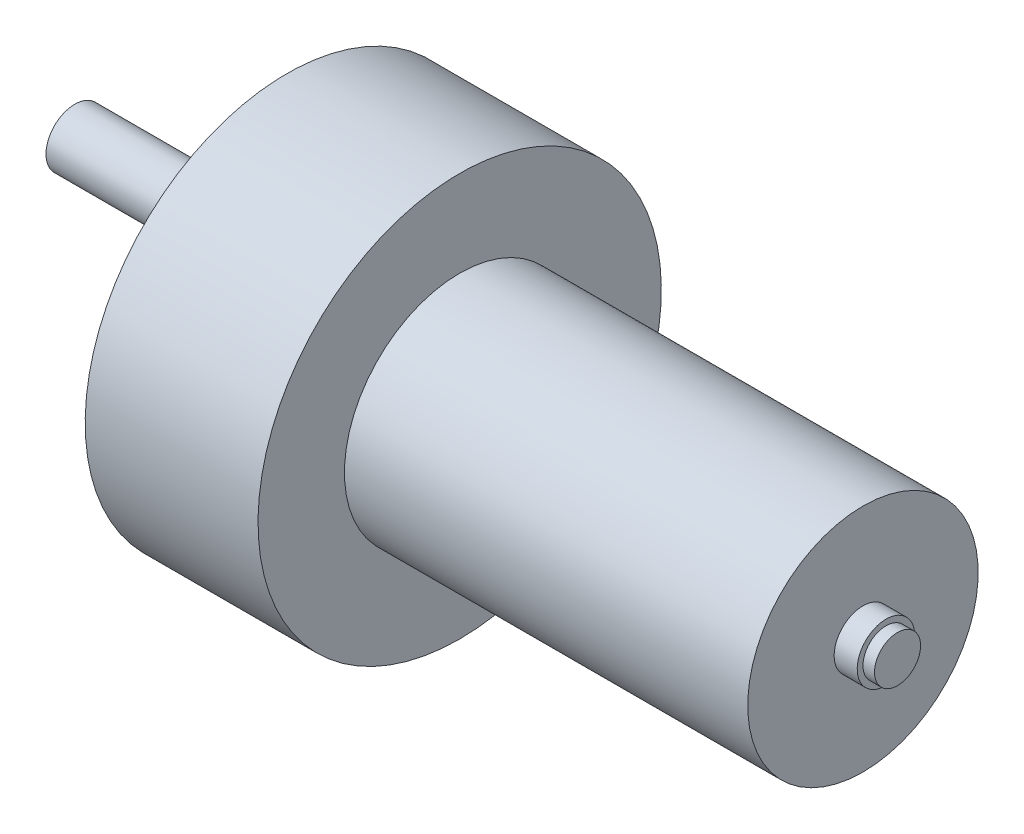
from build123d import *

# Parameters (mm, degrees)
SKETCH2_R           = 6
BOSS_EXTRUDE1_DEPTH = 6.8
SKETCH3_R           = 5
BOSS_EXTRUDE2_DEPTH = 30
SKETCH4_R           = 1.5
CUT_EXTRUDE1_DEPTH  = 3


with BuildPart() as part:
    # Sketch1 → Revolve1 (revolve)
    with BuildSketch(Plane.XY, mode=Mode.PRIVATE) as revolve1_sk:
        Polygon((70.300682485, 4), (70.300682485, 5), (66.300682485, 5), (66.300682485, 20), (-3.699317515, 20), (-3.699317515, 35), (-33.699317515, 35), (-33.699317515, 0), (72.300682485, 0), (72.300682485, 4), align=None)
    revolve(revolve1_sk.sketch.rotate(Axis((-33.699317515, 0, 0), (1, 0, 0)), 180), axis=Axis((-33.699317515, 0, 0), (1, 0, 0)))

    # Sketch2 → Boss-Extrude1 (add)
    with BuildSketch(Plane.ZY.offset(33.699317515)):
        with Locations(Location((0, 7, 0), (0, 0, 90))):
            Circle(SKETCH2_R)
    extrude(amount=BOSS_EXTRUDE1_DEPTH)

    # Sketch3 → Boss-Extrude2 (add)
    with BuildSketch(Plane.ZY.offset(40.499317515)):
        with Locations((0, 7)):
            Circle(SKETCH3_R)
    extrude(amount=BOSS_EXTRUDE2_DEPTH)

    # Sketch4 → Cut-Extrude1 (cut)
    with BuildSketch(Plane.ZY.offset(33.699317515)):
        with Locations((-15.75, 0)):
            Circle(SKETCH4_R)
        with Locations((-7.875, 13.63990011)):
            Circle(SKETCH4_R)
        with Locations((7.875, 13.63990011)):
            Circle(SKETCH4_R)
        with Locations((15.75, 0)):
            Circle(SKETCH4_R)
        with Locations((7.875, -13.63990011)):
            Circle(SKETCH4_R)
        with Locations((-7.875, -13.63990011)):
            Circle(SKETCH4_R)
    extrude(amount=-CUT_EXTRUDE1_DEPTH, mode=Mode.SUBTRACT)


solid = part.part
